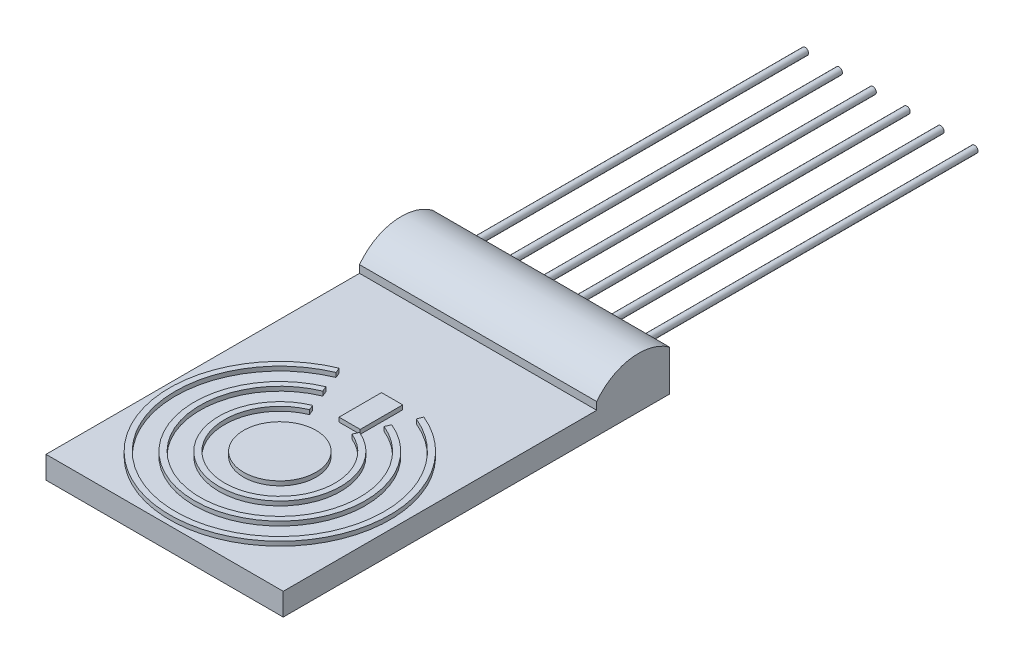
from build123d import *

# Parameters (mm, degrees)
SKETCH1_W           = 7
SKETCH1_H           = 11.4
BOSS_EXTRUDE1_DEPTH = 0.6604
BOSS_EXTRUDE2_DEPTH = 7
SKETCH4_R           = 1.07
SKETCH4_W           = 0.625641059
SKETCH4_H           = 1.254110087
BOSS_EXTRUDE3_DEPTH = 0.127
SKETCH5_R           = 0.1
BOSS_EXTRUDE4_DEPTH = 10


with BuildPart() as part:
    # Sketch1 → Boss-Extrude1 (new body)
    with BuildSketch(Plane(origin=(0, 0, 0), x_dir=(1, 0, 0), z_dir=(0, 1, 0))):
        with Locations((0, 5.7)):
            Rectangle(SKETCH1_W, SKETCH1_H)
    extrude(amount=BOSS_EXTRUDE1_DEPTH)

    # Sketch3 → Boss-Extrude2 (add)
    with BuildSketch(Plane.ZY.offset(3.5)):
        with BuildLine():
            Line((-11.4, 0.6604), (-11.4, 1.2))
            ThreePointArc((-11.4, 1.2), (-10.260013654, 1.483539887), (-9.25, 0.883676442))
            Line((-9.25, 0.883676442), (-9.25, 0.6604))
            Line((-9.25, 0.6604), (-11.4, 0.6604))
        make_face()
    extrude(amount=-BOSS_EXTRUDE2_DEPTH)

    # Sketch4 → Boss-Extrude3 (add)
    with BuildSketch(Plane(origin=(0, 0.6604, 0), x_dir=(1, 0, 0), z_dir=(0, 1, 0))):
        with Locations(Location((0, 3.4, 0), (0, 0, 270))):
            Circle(SKETCH4_R)
        with Locations((0.312820529, 5.772944956)):
            Rectangle(SKETCH4_W, SKETCH4_H)
        with BuildLine():
            Line((-0.625641059, 4.901538541), (-0.691025641, 5.058461538))
            ThreePointArc((-0.691025641, 5.058461538), (0, 1.603333333), (0.691025641, 5.058461538))
            Line((0.691025641, 5.058461538), (0.625641059, 4.901538541))
            ThreePointArc((0.625641059, 4.901538541), (0, 1.773333247), (-0.625641059, 4.901538541))
        make_face()
        with BuildLine():
            Line((0.905128238, 5.572307772), (0.970512821, 5.729230769))
            ThreePointArc((0.970512821, 5.729230769), (0, 0.876666667), (-0.970512821, 5.729230769))
            Line((-0.970512821, 5.729230769), (-0.905128238, 5.572307772))
            ThreePointArc((-0.905128238, 5.572307772), (0, 1.046666581), (0.905128238, 5.572307772))
        make_face()
        with BuildLine():
            Line((1.184615418, 6.243077002), (1.25, 6.4))
            ThreePointArc((1.25, 6.4), (0, 0.15), (-1.25, 6.4))
            Line((-1.25, 6.4), (-1.184615418, 6.243077002))
            ThreePointArc((-1.184615418, 6.243077002), (0, 0.319999914), (1.184615418, 6.243077002))
        make_face()
    extrude(amount=BOSS_EXTRUDE3_DEPTH)

    # Sketch5 → Boss-Extrude4 (add)
    with BuildSketch(Plane(origin=(0, 0, -11.4), x_dir=(-1, 0, 0), z_dir=(0, 0, -1))):
        with Locations(Location((-2.5, 0.7604, 0), (0, 0, 180))):
            Circle(SKETCH5_R)
        with Locations(Location((-1.5, 0.7604, 0), (0, 0, 180))):
            Circle(SKETCH5_R)
        with Locations(Location((-0.5, 0.7604, 0), (0, 0, 180))):
            Circle(SKETCH5_R)
        with Locations(Location((0.5, 0.7604, 0), (0, 0, 180))):
            Circle(SKETCH5_R)
        with Locations(Location((1.5, 0.7604, 0), (0, 0, 180))):
            Circle(SKETCH5_R)
        with Locations(Location((2.5, 0.7604, 0), (0, 0, 180))):
            Circle(SKETCH5_R)
    extrude(amount=BOSS_EXTRUDE4_DEPTH)


solid = part.part
